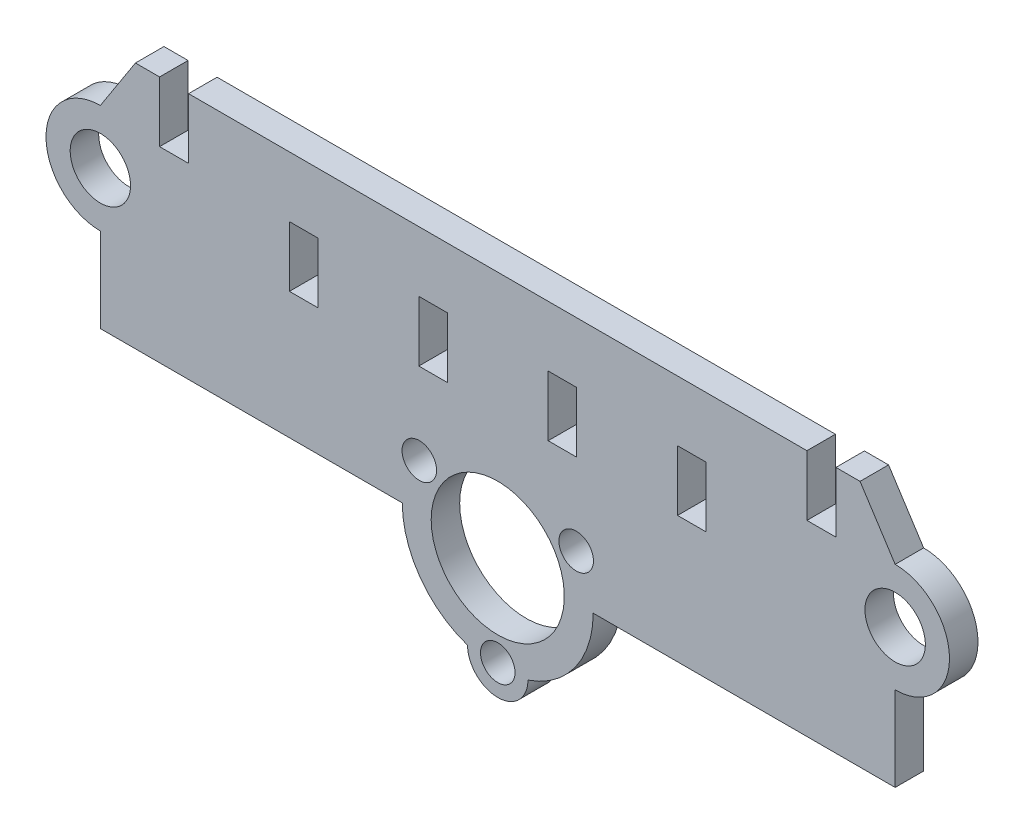
from build123d import *

# Parameters (mm, degrees)
SKETCH2_R           = 3.175
SKETCH2_R_2         = 7
SKETCH2_R_3         = 1.8161
BOSS_EXTRUDE1_DEPTH = 2.9972
SKETCH3_W           = 2.9972
SKETCH3_H           = 6.35
CUT_EXTRUDE1_DEPTH  = 55.254506352


with BuildPart() as part:
    # Sketch2 → Boss-Extrude1 (new body)
    with BuildSketch(Plane.XY):
        with BuildLine():
            Line((-35.56, 26.035), (-38.1, 26.035))
            Line((-38.1, 26.035), (-41.790231571, 20.32))
            ThreePointArc((-41.790231571, 20.32), (-47.505231571, 14.605), (-41.790231571, 8.89))
            Line((-41.790231571, 8.89), (-41.790231571, 0))
            Line((-41.790231571, 0), (-10.040231571, 0))
            ThreePointArc((-10.040231571, 0), (-8.145059399, -5.87062666), (-3.175, -9.525))
            ThreePointArc((-3.175, -9.525), (0, -12.7), (3.175, -9.525))
            ThreePointArc((3.175, -9.525), (8.145059399, -5.87062666), (10.040231571, 0))
            Line((10.040231571, 0), (41.790231571, 0))
            Line((41.790231571, 0), (41.790231571, 8.89))
            ThreePointArc((41.790231571, 8.89), (47.505231571, 14.605), (41.790231571, 20.32))
            Line((41.790231571, 20.32), (38.1, 26.035))
            Line((38.1, 26.035), (35.56, 26.035))
            Line((35.56, 26.035), (35.56, 19.685))
            Line((35.56, 19.685), (32.512, 19.685))
            Line((32.512, 19.685), (32.512, 26.035))
            Line((32.512, 26.035), (-32.512, 26.035))
            Line((-32.512, 26.035), (-32.512, 19.685))
            Line((-32.512, 19.685), (-35.56, 19.685))
            Line((-35.56, 19.685), (-35.56, 26.035))
        make_face()
        with Locations((41.790231571, 14.605)):
            Circle(SKETCH2_R, mode=Mode.SUBTRACT)
        Circle(SKETCH2_R_2, mode=Mode.SUBTRACT)
        with Locations((8.248891971, 4.7625)):
            Circle(SKETCH2_R_3, mode=Mode.SUBTRACT)
        with Locations((-8.248891971, 4.7625)):
            Circle(SKETCH2_R_3, mode=Mode.SUBTRACT)
        with Locations((-41.790231571, 14.605)):
            Circle(SKETCH2_R, mode=Mode.SUBTRACT)
        with Locations((0, -9.525)):
            Circle(SKETCH2_R_3, mode=Mode.SUBTRACT)
    extrude(amount=BOSS_EXTRUDE1_DEPTH)

    # Sketch3 → Cut-Extrude1 (cut, through all)
    with BuildSketch(Plane(origin=(0, 0, 0), x_dir=(-1, 0, 0), z_dir=(0, 0, -1))):
        with Locations((-20.40636, 16.51)):
            Rectangle(SKETCH3_W, SKETCH3_H)
        with Locations((-6.80212, 16.51)):
            Rectangle(SKETCH3_W, SKETCH3_H)
        with Locations((6.80212, 16.51)):
            Rectangle(SKETCH3_W, SKETCH3_H)
        with Locations((20.40636, 16.51)):
            Rectangle(SKETCH3_W, SKETCH3_H)
    extrude(amount=-CUT_EXTRUDE1_DEPTH, mode=Mode.SUBTRACT)


solid = part.part
